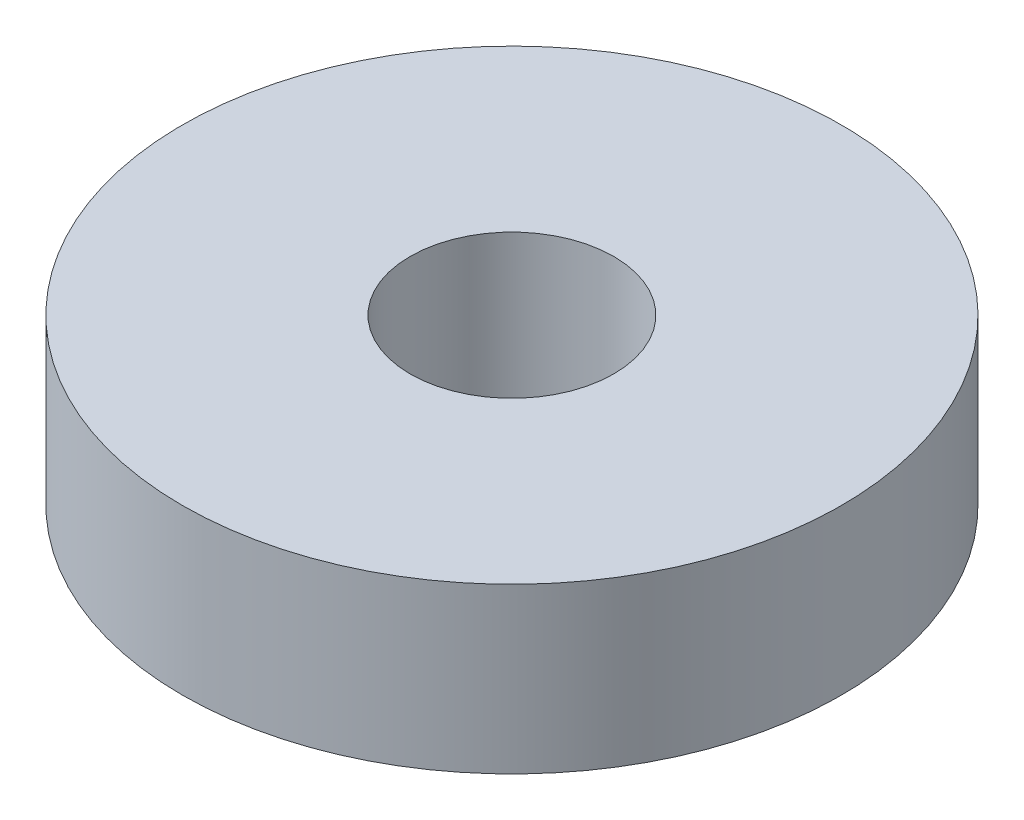
from build123d import *

# Parameters (mm, degrees)
SKETCH1_R           = 20.6375
SKETCH1_R_2         = 6.3754
BOSS_EXTRUDE1_DEPTH = 10.287


with BuildPart() as part:
    # Sketch1 → Boss-Extrude1 (new body)
    with BuildSketch(Plane(origin=(0, 0, 0), x_dir=(1, 0, 0), z_dir=(0, 1, 0))):
        with Locations(Location((0, 0, 0), (0, 0, 270))):
            Circle(SKETCH1_R)
        with Locations(Location((0, 0, 0), (0, 0, 270))):
            Circle(SKETCH1_R_2, mode=Mode.SUBTRACT)
    extrude(amount=BOSS_EXTRUDE1_DEPTH)


solid = part.part
